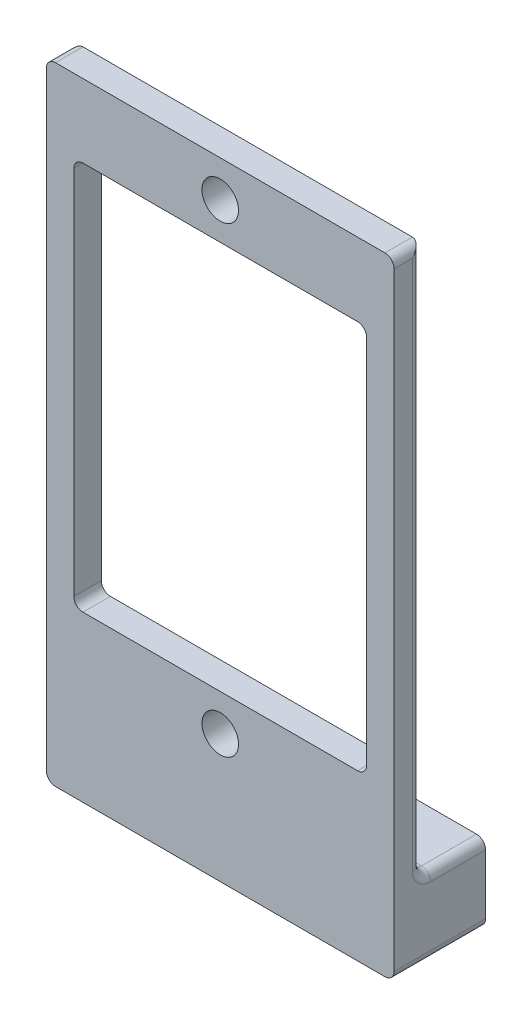
from build123d import *

# Parameters (mm, degrees)
SKETCH_1_R      = 2
SKETCH_1_W      = 32
SKETCH_1_H      = 42.5
EXTRUDE_1_DEPTH = 3
SKETCH_2_W      = 38
SKETCH_2_H      = 8.5
EXTRUDE_2_DEPTH = 7
FILLET_1_R      = 1


with BuildPart() as part:
    # 草图1 → 凸台-拉伸1 (new body)
    with BuildSketch(Plane.XY):
        Polygon((0, 29.25), (23, 29.25), (23, -39.25), (-15, -39.25), (-15, 29.25), align=None)
        with Locations((4, 25.25)):
            Circle(SKETCH_1_R, mode=Mode.SUBTRACT)
        with Locations((4, -25.25)):
            Circle(SKETCH_1_R, mode=Mode.SUBTRACT)
        with Locations((4, 0)):
            Rectangle(SKETCH_1_W, SKETCH_1_H, mode=Mode.SUBTRACT)
    extrude(amount=EXTRUDE_1_DEPTH)

    # 草图2 → 凸台-拉伸2 (add)
    with BuildSketch(Plane(origin=(0, 0, 0), x_dir=(-1, 0, 0), z_dir=(0, 0, -1))):
        with Locations((-4, -35)):
            Rectangle(SKETCH_2_W, SKETCH_2_H)
    extrude(amount=EXTRUDE_2_DEPTH)

    # 圆角1
    fillet_1_edges = [part.edges().sort_by_distance(p)[0] for p in [
        (-12, -21.25, 1.5),
        (20, -21.25, 1.5),
        (20, 21.25, 1.5),
        (-12, 21.25, 1.5),
        (23, -0.75, 0),
        (23, -30.75, -3.5),
        (4, -30.75, 0),
        (-15, -30.75, -3.5),
        (-15, -0.75, 0),
        (-15, -39.25, -2),
        (-15, 29.25, 1.5),
        (23, 29.25, 1.5),
        (23, -39.25, -2),
    ]]
    fillet(fillet_1_edges, radius=FILLET_1_R)


solid = part.part
